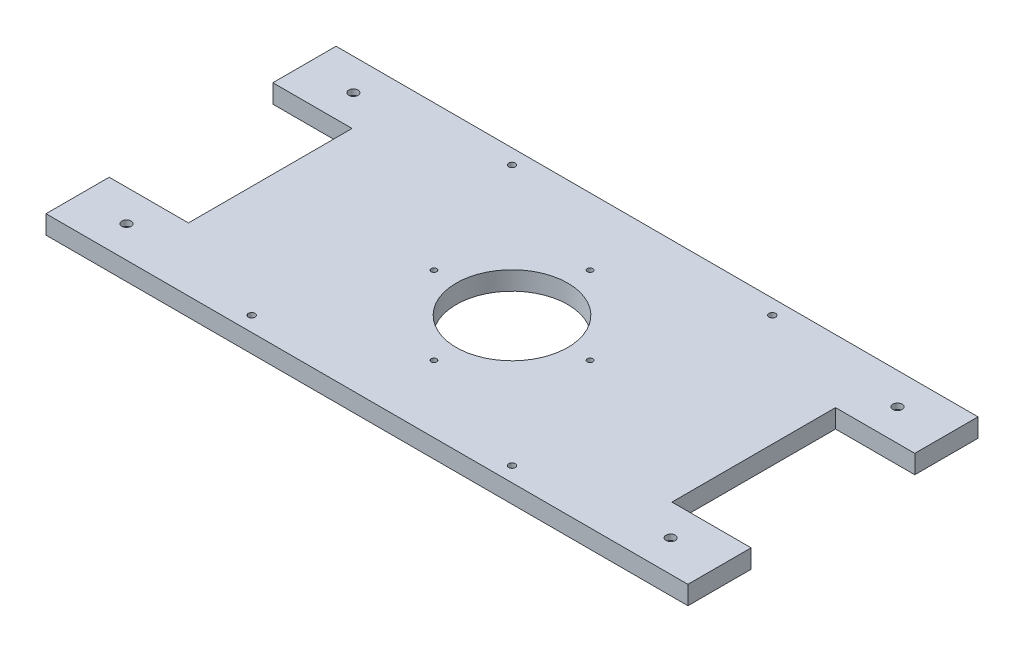
from build123d import *

# Parameters (mm, degrees)
SKETCH_1_W          = 172.6
SKETCH_1_H          = 78
SKETCH_1_R          = 1.25
EXTRUDE_1_DEPTH     = 5
SKETCH_2_W          = 21.3
SKETCH_2_H          = 44
CUT_EXTRUDE_1_DEPTH = 95.835067354
SKETCH_1_3_R        = 2
CUT_EXTRUDE_2_DEPTH = 3.5
SKETCH_3_R          = 0.9
CUT_EXTRUDE_3_DEPTH = 95.835067354
SKETCH_4_R          = 15
CUT_EXTRUDE_4_DEPTH = 95.835067354
SKETCH_5_R          = 0.75
CUT_EXTRUDE_5_DEPTH = 95.835067354


with BuildPart() as part:
    # 草图1 → 凸台-拉伸1 (new body)
    with BuildSketch(Plane(origin=(0, 0, 0), x_dir=(1, 0, 0), z_dir=(0, 1, 0))):
        Rectangle(SKETCH_1_W, SKETCH_1_H)
        with Locations(Location((-73.15, 30.5, 0), (0, 0, 270))):
            Circle(SKETCH_1_R, mode=Mode.SUBTRACT)
        with Locations(Location((-73.15, -30.5, 0), (0, 0, 270))):
            Circle(SKETCH_1_R, mode=Mode.SUBTRACT)
        with Locations(Location((73.15, 30.5, 0), (0, 0, 270))):
            Circle(SKETCH_1_R, mode=Mode.SUBTRACT)
        with Locations(Location((73.15, -30.5, 0), (0, 0, 270))):
            Circle(SKETCH_1_R, mode=Mode.SUBTRACT)
    extrude(amount=EXTRUDE_1_DEPTH)

    # 草图2 → 切除-拉伸1 (cut, through all)
    with BuildSketch(Plane(origin=(0, 5, 0), x_dir=(1, 0, 0), z_dir=(0, 1, 0))):
        with Locations((-75.65, 0)):
            Rectangle(SKETCH_2_W, SKETCH_2_H)
        with Locations((75.65, 0)):
            Rectangle(SKETCH_2_W, SKETCH_2_H)
    extrude(amount=-CUT_EXTRUDE_1_DEPTH, mode=Mode.SUBTRACT)

    # 草图1<3> → 切除-拉伸2 (cut)
    with BuildSketch(Plane(origin=(0, 0, 0), x_dir=(1, 0, 0), z_dir=(0, 1, 0))):
        with Locations(Location((-73.15, 30.5, 0), (0, 0, 90))):
            Circle(SKETCH_1_3_R)
        with Locations(Location((-73.15, -30.5, 0), (0, 0, 90))):
            Circle(SKETCH_1_3_R)
        with Locations(Location((73.15, 30.5, 0), (0, 0, 90))):
            Circle(SKETCH_1_3_R)
        with Locations(Location((73.15, -30.5, 0), (0, 0, 90))):
            Circle(SKETCH_1_3_R)
    extrude(amount=CUT_EXTRUDE_2_DEPTH, mode=Mode.SUBTRACT)

    # 草图3 → 切除-拉伸3 (cut, through all)
    with BuildSketch(Plane(origin=(0, 5, 0), x_dir=(1, 0, 0), z_dir=(0, 1, 0))):
        with Locations(Location((-35, 35, 0), (0, 0, 270))):
            Circle(SKETCH_3_R)
        with Locations(Location((35, 35, 0), (0, 0, 270))):
            Circle(SKETCH_3_R)
        with Locations(Location((-35, -35, 0), (0, 0, 270))):
            Circle(SKETCH_3_R)
        with Locations(Location((35, -35, 0), (0, 0, 270))):
            Circle(SKETCH_3_R)
    extrude(amount=-CUT_EXTRUDE_3_DEPTH, mode=Mode.SUBTRACT)

    # 草图4 → 切除-拉伸4 (cut, through all)
    with BuildSketch(Plane.XZ):
        with Locations(Location((0, 0, 0), (0, 0, 270))):
            Circle(SKETCH_4_R)
    extrude(amount=-CUT_EXTRUDE_4_DEPTH, mode=Mode.SUBTRACT)

    # 草图5 → 切除-拉伸5 (cut, through all)
    with BuildSketch(Plane(origin=(0, 5, 0), x_dir=(1, 0, 0), z_dir=(0, 1, 0))):
        with Locations(Location((0, 21, 0), (0, 0, 270))):
            Circle(SKETCH_5_R)
        with Locations(Location((21, 0, 0), (0, 0, 270))):
            Circle(SKETCH_5_R)
        with Locations(Location((-21, 0, 0), (0, 0, 270))):
            Circle(SKETCH_5_R)
        with Locations(Location((0, -21, 0), (0, 0, 270))):
            Circle(SKETCH_5_R)
    extrude(amount=-CUT_EXTRUDE_5_DEPTH, mode=Mode.SUBTRACT)


solid = part.part
